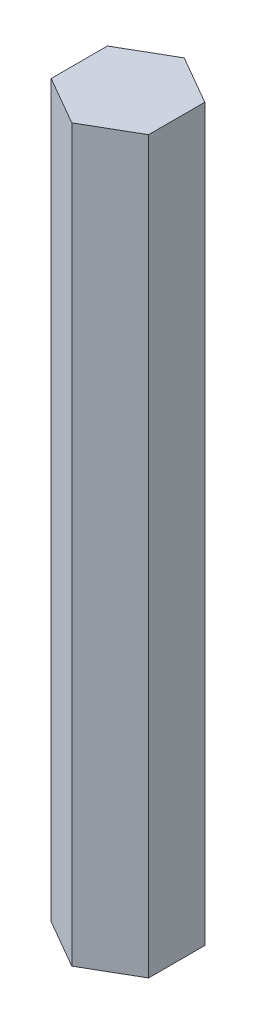
from build123d import *

# Parameters (mm, degrees)
EXTRUDE_1_DEPTH = 45


with BuildPart() as part:
    # 스케치1 → 보스-돌출1 (new body)
    with BuildSketch(Plane(origin=(0, 0, 0), x_dir=(1, 0, 0), z_dir=(0, 1, 0))):
        Polygon((0, -3.464101615), (3, -1.732050808), (3, 1.732050808), (0, 3.464101615), (-3, 1.732050808), (-3, -1.732050808), align=None)
    extrude(amount=EXTRUDE_1_DEPTH)


solid = part.part
